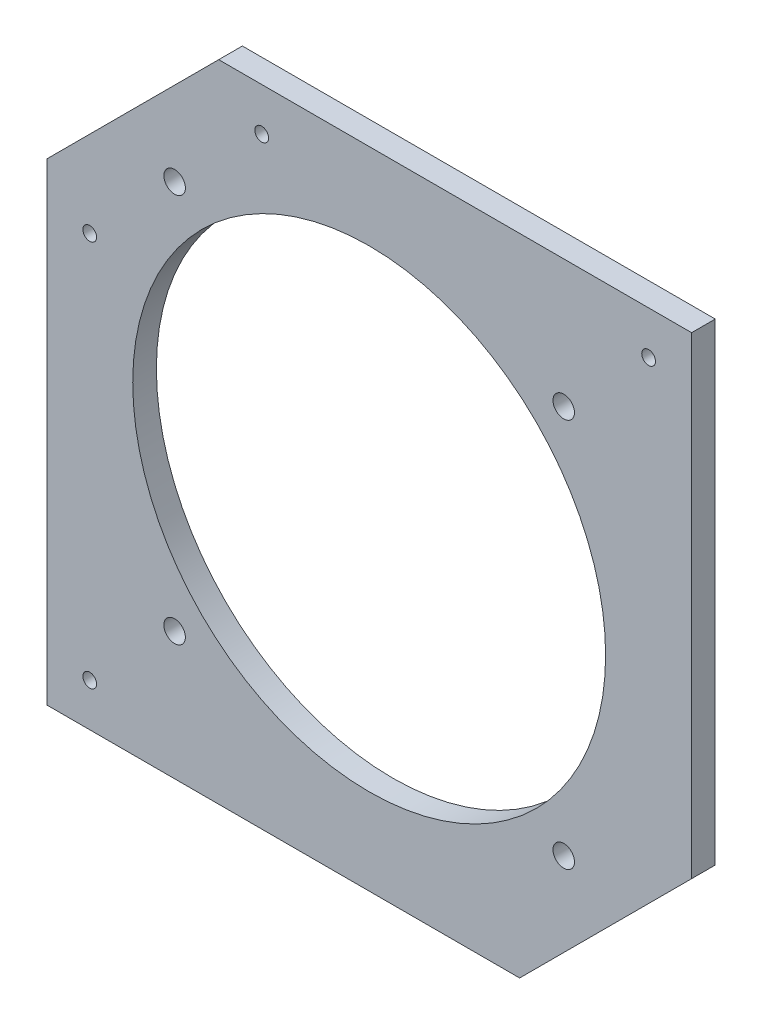
from build123d import *

# Parameters (mm, degrees)
SKETCH_1_W                       = 150
SKETCH_1_H                       = 150
EXTRUDE_1_DEPTH                  = 5.5
SKETCH_2_R                       = 2.5
CUT_EXTRUDE_1_DEPTH              = 107.208521315
CUT_EXTRUDE_2_DEPTH              = 107.208521315
CUT_EXTRUDE_2_DEPTH_BACK         = 107.208521315
SKETCH_3_R                       = 55
PATTERN_CIRCULAR_1_COUNT         = 4
SKETCH_4_R                       = 1.6
CUT_EXTRUDE_3_DEPTH              = 107.208521315
CHAMFER_1_SIZE                   = 40
CHAMFER_2_SIZE                   = 40
PATTERN_LINEAR_1_COUNT           = 2
PATTERN_LINEAR_1_PITCH           = 90
PATTERN_LINEAR_2_COPY_1_SKETCH_R = 1.6
PATTERN_LINEAR_2_COPY_1_DEPTH    = 107.208521315
PATTERN_LINEAR_2_COPY_2_SKETCH_R = 1.6
PATTERN_LINEAR_2_COPY_2_DEPTH    = 107.208521315


with BuildPart() as part:
    # ｽｹｯﾁ1 → ﾎﾞｽ - 押し出し1 (new body)
    with BuildSketch(Plane.XY):
        Rectangle(SKETCH_1_W, SKETCH_1_H)
    extrude(amount=EXTRUDE_1_DEPTH)

    # ｽｹｯﾁ2 → ｶｯﾄ - 押し出し1 (cut, symmetric)
    with BuildSketch(Plane(origin=(0, 0, 0), x_dir=(-1, 0, 0), z_dir=(0, 0, -1))):
        with Locations((-45.254833996, -45.254833996)):
            Circle(SKETCH_2_R)
    cut_extrude_1 = extrude(amount=CUT_EXTRUDE_1_DEPTH, both=True, mode=Mode.SUBTRACT)

    # ｽｹｯﾁ3 → ｶｯﾄ - 押し出し2 (cut, two sides: drawn at the far end of the back side and taken through both)
    with BuildSketch(Plane(origin=(0, 0, 0), x_dir=(-1, 0, 0), z_dir=(0, 0, -1)).offset(-CUT_EXTRUDE_2_DEPTH_BACK)):
        Circle(SKETCH_3_R)
    extrude(amount=CUT_EXTRUDE_2_DEPTH + CUT_EXTRUDE_2_DEPTH_BACK, mode=Mode.SUBTRACT)

    # 円形ﾊﾟﾀｰﾝ1: ｶｯﾄ - 押し出し1 ×4 about axis
    pattern_circular_1_axis = Axis((0, 0, 0), (0, 0, 1))
    for i in range(1, PATTERN_CIRCULAR_1_COUNT):
        add(cut_extrude_1.rotate(pattern_circular_1_axis, i * 360 / PATTERN_CIRCULAR_1_COUNT), mode=Mode.SUBTRACT)

    # ｽｹｯﾁ4 → ｶｯﾄ - 押し出し3 (cut, symmetric)
    with BuildSketch(Plane(origin=(0, 0, 0), x_dir=(-1, 0, 0), z_dir=(0, 0, -1))):
        with Locations((65, -65)):
            Circle(SKETCH_4_R)
    cut_extrude_3 = extrude(amount=CUT_EXTRUDE_3_DEPTH, both=True, mode=Mode.SUBTRACT)

    # 面取り1
    chamfer_1_edges = [part.edges().sort_by_distance(p)[0] for p in [
        (-75, 75, 2.75),
    ]]
    chamfer(chamfer_1_edges, length=CHAMFER_1_SIZE)

    # 面取り2
    chamfer_2_edges = [part.edges().sort_by_distance(p)[0] for p in [
        (75, -75, 2.75),
    ]]
    chamfer(chamfer_2_edges, length=CHAMFER_2_SIZE)

    # 直線ﾊﾟﾀｰﾝ1: ｶｯﾄ - 押し出し3 ×2
    with Locations(*[(0, i * PATTERN_LINEAR_1_PITCH, 0) for i in range(1, PATTERN_LINEAR_1_COUNT)]):
        add(cut_extrude_3, mode=Mode.SUBTRACT)

    # ﾐﾗｰ1: ｶｯﾄ - 押し出し3 across plane
    add(cut_extrude_3.mirror(Plane(origin=(0, 0, 0), x_dir=(0, 0, 1), z_dir=(-0.7071067811865475, -0.7071067811865476, 0))), mode=Mode.SUBTRACT)

    # 直線ﾊﾟﾀｰﾝ2 copy 1 sketch → 直線ﾊﾟﾀｰﾝ2 copy 1 (cut, symmetric)
    with BuildSketch(Plane(origin=(-90, 0, 0), x_dir=(0, 1, 0), z_dir=(0, 0, -1))):
        with Locations((65, 65)):
            Circle(PATTERN_LINEAR_2_COPY_1_SKETCH_R)
    extrude(amount=PATTERN_LINEAR_2_COPY_1_DEPTH, both=True, mode=Mode.SUBTRACT)

    # 直線ﾊﾟﾀｰﾝ2 copy 2 sketch → 直線ﾊﾟﾀｰﾝ2 copy 2 (cut, symmetric)
    with BuildSketch(Plane(origin=(-90, 0, 0), x_dir=(-1, 0, 0), z_dir=(0, 0, -1))):
        with Locations((65, -65)):
            Circle(PATTERN_LINEAR_2_COPY_2_SKETCH_R)
    extrude(amount=PATTERN_LINEAR_2_COPY_2_DEPTH, both=True, mode=Mode.SUBTRACT)


solid = part.part
